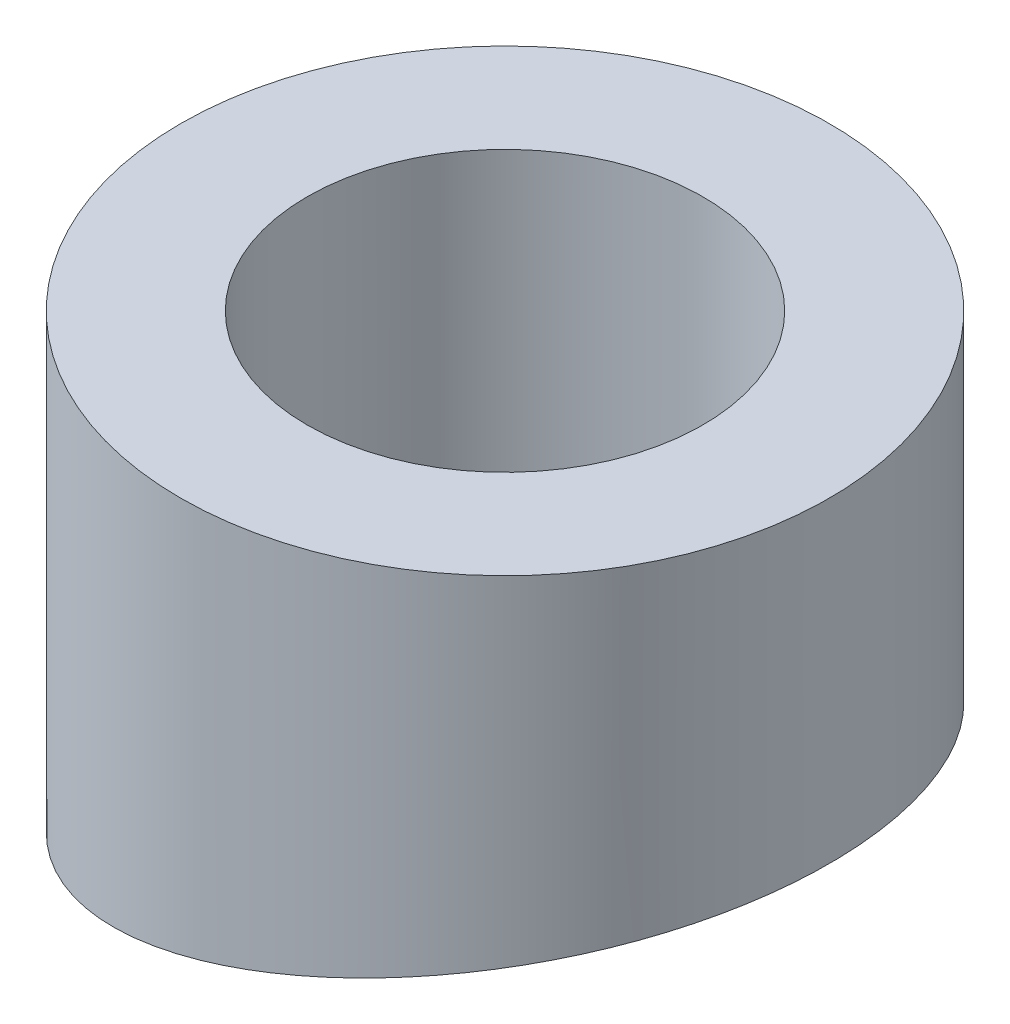
from build123d import *

# Parameters (mm, degrees)
SKETCH1_R           = 10.25
SKETCH1_R_2         = 6.25
BOSS_EXTRUDE1_DEPTH = 15
CUT_EXTRUDE1_DEPTH  = 15


with BuildPart() as part:
    # Sketch1 → Boss-Extrude1 (new body)
    with BuildSketch(Plane(origin=(0, 0, 0), x_dir=(1, 0, 0), z_dir=(0, 1, 0))):
        with Locations(Location((0, 0, 0), (0, 0, 270))):
            Circle(SKETCH1_R)
        with Locations(Location((0, 0, 0), (0, 0, 270))):
            Circle(SKETCH1_R_2, mode=Mode.SUBTRACT)
    extrude(amount=BOSS_EXTRUDE1_DEPTH)

    # Sketch3 → Cut-Extrude1 (cut, symmetric)
    with BuildSketch(Plane.XY):
        Polygon((-10.25, 0), (10.25, 5), (10.25, 0), align=None)
    extrude(amount=CUT_EXTRUDE1_DEPTH, both=True, mode=Mode.SUBTRACT)


solid = part.part
